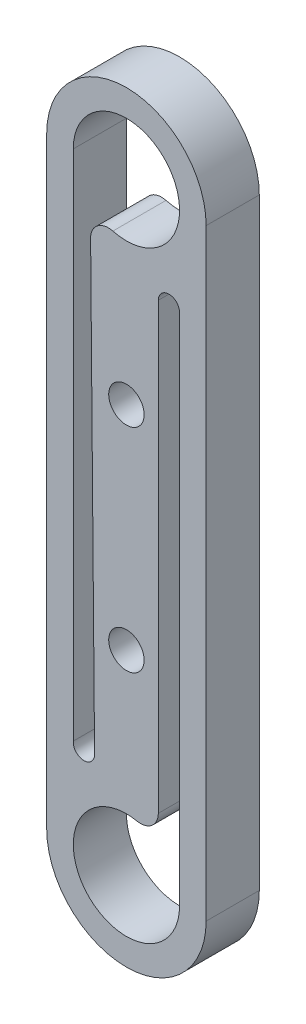
from build123d import *

# Parameters (mm, degrees)
SKETCH_1_R      = 1
EXTRUDE_1_DEPTH = 3


with BuildPart() as part:
    # 草图1 → 凸台-拉伸1 (new body)
    with BuildSketch(Plane.XY):
        with BuildLine():
            Line((-470.172785233, 43.756242), (-470.172785233, 77.756242))
            ThreePointArc((-470.172785233, 77.756242), (-474.672785233, 82.256242), (-479.172785233, 77.756242))
            Line((-479.172785233, 77.756242), (-479.172785233, 43.756242))
            ThreePointArc((-479.172785233, 43.756242), (-474.672785233, 39.256242), (-470.172785233, 43.756242))
        make_face()
        with Locations((-474.672785233, 66.756242)):
            Circle(SKETCH_1_R, mode=Mode.SUBTRACT)
        with Locations((-474.672785233, 54.756242)):
            Circle(SKETCH_1_R, mode=Mode.SUBTRACT)
        with BuildLine():
            Line((-472.873395696, 72.756242), (-472.873395696, 47.675550149))
            ThreePointArc((-472.873395696, 47.675550149), (-473.24087984, 46.901002738), (-474.07324308, 46.695723112))
            ThreePointArc((-474.07324308, 46.695723112), (-476.996427467, 41.858694433), (-471.672785233, 43.756242))
            Line((-471.672785233, 43.756242), (-471.672174771, 72.756229357))
            ThreePointArc((-471.672174771, 72.756229357), (-472.272778912, 73.356852463), (-472.873395696, 72.756242))
        make_face(mode=Mode.SUBTRACT)
        with BuildLine():
            Line((-476.470594729, 48.756242), (-476.694432062, 73.880013915))
            ThreePointArc((-476.694432062, 73.880013915), (-476.308150012, 74.678479143), (-475.439050119, 74.855752709))
            ThreePointArc((-475.439050119, 74.855752709), (-472.295939145, 79.586707151), (-477.672785233, 77.756242))
            Line((-477.672785233, 77.756242), (-477.672785233, 48.807558702))
            ThreePointArc((-477.672785233, 48.807558702), (-477.09846695, 48.154599371), (-476.470594729, 48.756242))
        make_face(mode=Mode.SUBTRACT)
    extrude(amount=EXTRUDE_1_DEPTH)


solid = part.part
